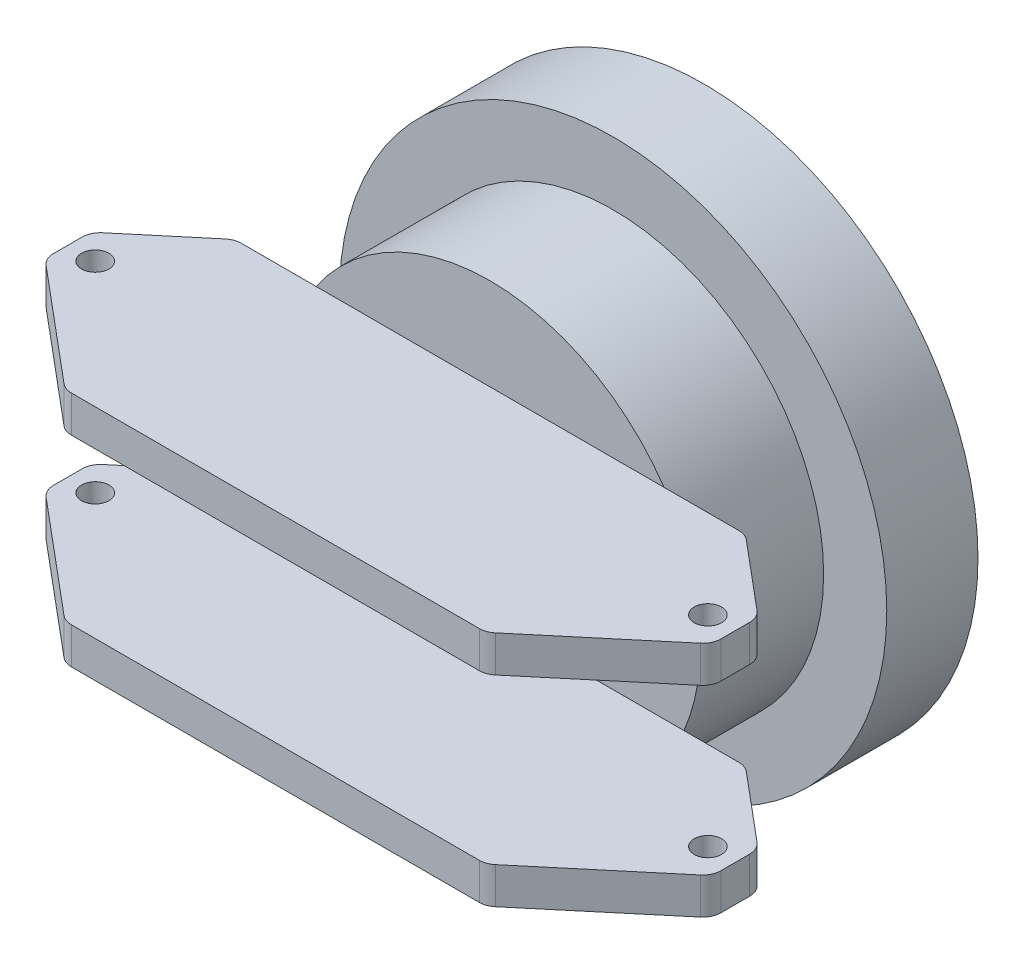
from build123d import *

# Parameters (mm, degrees)
SKETCH1_R               = 30
BOSS_EXTRUDE1_DEPTH     = 10
SKETCH2_R               = 23.08
BOSS_EXTRUDE2_DEPTH     = 13.486192569
BOSS_EXTRUDE3_DEPTH     = 4
FILLET1_R               = 2
SKETCH5_R               = 1.5
CUT_EXTRUDE1_DEPTH      = 4
MIRROR2_COPY_1_SKETCH_R = 1.5
MIRROR2_COPY_1_DEPTH    = 4
FILLET1_OF_MIRROR2_R    = 2
SKETCH8_R               = 15
BOSS_EXTRUDE4_DEPTH     = 5
SKETCH13_R              = 2.5
BOSS_EXTRUDE6_DEPTH     = 10


with BuildPart() as part:
    # Sketch1 → Boss-Extrude1 (new body)
    with BuildSketch(Plane.XY):
        Circle(SKETCH1_R)
    extrude(amount=BOSS_EXTRUDE1_DEPTH)

    # Sketch2 → Boss-Extrude2 (add)
    with BuildSketch(Plane.XY.offset(10)):
        Circle(SKETCH2_R)
    extrude(amount=BOSS_EXTRUDE2_DEPTH)

    # Sketch4 → Boss-Extrude3 (add)
    with BuildSketch(Plane(origin=(0, 13, 0), x_dir=(1, 0, 0), z_dir=(0, 1, 0))):
        Polygon((28, -23.486192569), (-28, -23.486192569), (-36.579697763, -30.685413797), (-36.579697763, -35.685413797), (-23.08, -47.013005211), (23.08, -47.013005211), (36.579697763, -35.685413797), (36.579697763, -30.685413797), align=None)
    boss_extrude3 = extrude(amount=-BOSS_EXTRUDE3_DEPTH)

    # Fillet1
    fillet1_edges = [part.edges().sort_by_distance(p)[0] for p in [
        (-36.579697763, 11, 30.685413797),
        (-28, 11, 23.486192569),
        (28, 11, 23.486192569),
        (36.579697763, 11, 30.685413797),
        (36.579697763, 11, 35.685413797),
        (23.08, 11, 47.013005211),
        (-23.08, 11, 47.013005211),
        (-36.579697763, 11, 35.685413797),
    ]]
    fillet(fillet1_edges, radius=FILLET1_R)

    # Sketch5 → Cut-Extrude1 (cut)
    with BuildSketch(Plane(origin=(0, 13, 0), x_dir=(1, 0, 0), z_dir=(0, 1, 0))):
        with Locations(Location((-33.579697763, -33.185413797, 0), (0, 0, 270))):
            Circle(SKETCH5_R)
    cut_extrude1 = extrude(amount=-CUT_EXTRUDE1_DEPTH, mode=Mode.SUBTRACT)

    # Mirror1: Cut-Extrude1 across plane
    add(cut_extrude1.mirror(Plane(origin=(0, 0, 0), x_dir=(0, 0, 1), z_dir=(1, 0, 0))), mode=Mode.SUBTRACT)

    # Mirror2: Boss-Extrude3, Cut-Extrude1 across plane
    add(boss_extrude3.mirror(Plane.ZX))
    add(cut_extrude1.mirror(Plane.ZX), mode=Mode.SUBTRACT)

    # Mirror2 copy 1 sketch → Mirror2 copy 1 (cut)
    with BuildSketch(Plane(origin=(0, -13, 0), x_dir=(-1, 0, 0), z_dir=(0, -1, 0))):
        with Locations(Location((-33.579697763, -33.185413797, 0), (0, 0, 270))):
            Circle(MIRROR2_COPY_1_SKETCH_R)
    extrude(amount=-MIRROR2_COPY_1_DEPTH, mode=Mode.SUBTRACT)

    # Fillet1 of Mirror2
    fillet1_of_mirror2_edges = [part.edges().sort_by_distance(p)[0] for p in [
        (-36.579697763, -11, 30.685413797),
        (-28, -11, 23.486192569),
        (28, -11, 23.486192569),
        (36.579697763, -11, 30.685413797),
        (36.579697763, -11, 35.685413797),
        (23.08, -11, 47.013005211),
        (-23.08, -11, 47.013005211),
        (-36.579697763, -11, 35.685413797),
    ]]
    fillet(fillet1_of_mirror2_edges, radius=FILLET1_OF_MIRROR2_R)

    # Sketch8 → Boss-Extrude4 (add)
    with BuildSketch(Plane(origin=(0, 0, 0), x_dir=(-1, 0, 0), z_dir=(0, 0, -1))):
        with Locations(Location((0, 0, 0), (0, 0, 180))):
            Circle(SKETCH8_R)
    extrude(amount=BOSS_EXTRUDE4_DEPTH)

    # Sketch13 → Boss-Extrude6 (add)
    with BuildSketch(Plane(origin=(0, 0, -5), x_dir=(-1, 0, 0), z_dir=(0, 0, -1))):
        Circle(SKETCH13_R)
    extrude(amount=BOSS_EXTRUDE6_DEPTH)


solid = part.part
